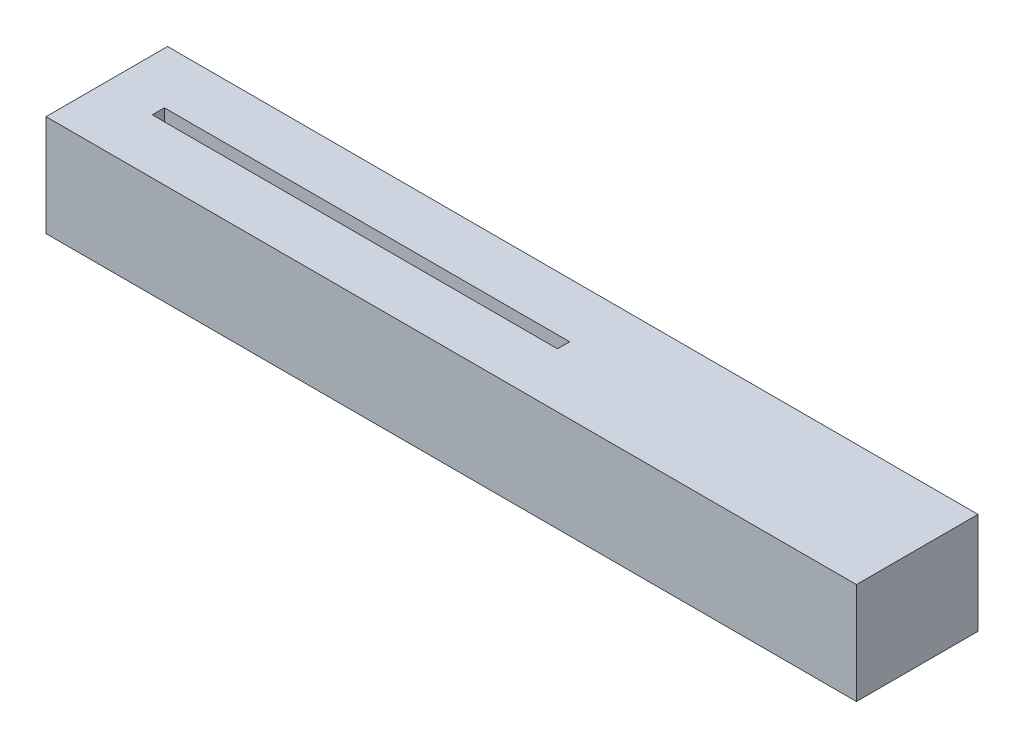
from build123d import *

# Parameters (mm, degrees)
EXTRUDE_1_DEPTH = 5


with BuildPart() as part:
    # 草图1 → 凸台-拉伸1 (new body)
    with BuildSketch(Plane(origin=(0, 0, 0), x_dir=(1, 0, 0), z_dir=(0, 1, 0))):
        Polygon((0, 6), (0, 3), (2.544321256, 3), (2.544321256, 3.3), (22.544321256, 3.3), (22.544321256, 3), (40, 3), (40, 6), align=None)
        Polygon((2.544321256, 3), (0, 3), (0, 0), (40, 0), (40, 3), (22.544321256, 3), (22.544321256, 2.7), (2.544321256, 2.7), align=None)
    extrude(amount=EXTRUDE_1_DEPTH)


solid = part.part
